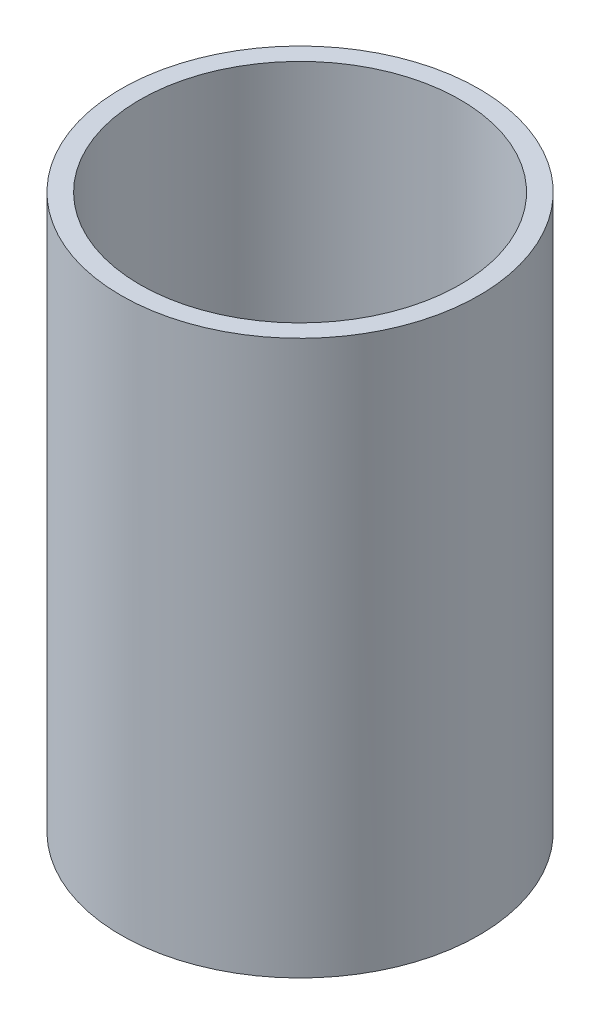
from build123d import *

# Parameters (mm, degrees)
SKETCH1_R           = 19
SKETCH1_R_2         = 17
BOSS_EXTRUDE1_DEPTH = 58.8
SKETCH2_R           = 10.45
CUT_EXTRUDE1_DEPTH  = 65.648588538


with BuildPart() as part:
    # Sketch1 → Boss-Extrude1 (new body)
    with BuildSketch(Plane(origin=(0, 0, 0), x_dir=(1, 0, 0), z_dir=(0, 1, 0))):
        with Locations(Location((0, 0, 0), (0, 0, 270))):
            Circle(SKETCH1_R)
        with Locations(Location((0, 0, 0), (0, 0, 270))):
            Circle(SKETCH1_R_2, mode=Mode.SUBTRACT)
    extrude(amount=BOSS_EXTRUDE1_DEPTH)

    # Sketch2 → Cut-Extrude1 (cut, through all)
    with BuildSketch(Plane.XY):
        Circle(SKETCH2_R)
    extrude(amount=-CUT_EXTRUDE1_DEPTH, mode=Mode.SUBTRACT)


solid = part.part
